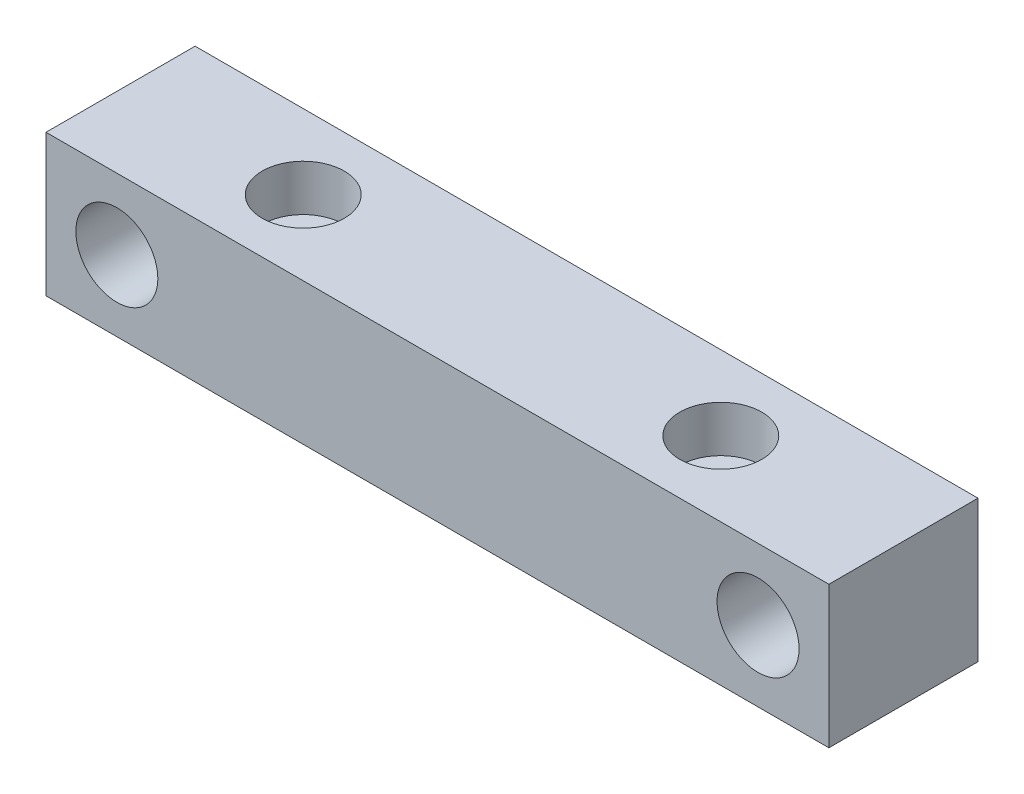
from build123d import *

# Parameters (mm, degrees)
SKETCH1_W           = 52.5
SKETCH1_H           = 9.5
SKETCH1_R           = 1.375
BOSS_EXTRUDE1_DEPTH = 10
SKETCH4_R           = 2.75
CUT_EXTRUDE3_DEPTH  = 7
CUT_EXTRUDE1_REACH  = 54.832
SKETCH2_R           = 1.375
SKETCH3_R           = 2.75
CUT_EXTRUDE2_DEPTH  = 3.1


with BuildPart() as part:
    # Sketch1 → Boss-Extrude1 (new body)
    with BuildSketch(Plane.XY):
        with Locations((-24.75, -6.748746096)):
            Rectangle(SKETCH1_W, SKETCH1_H)
        with Locations((-46.25, -6.748746096)):
            Circle(SKETCH1_R, mode=Mode.SUBTRACT)
        with Locations((-3.25, -6.748746096)):
            Circle(SKETCH1_R, mode=Mode.SUBTRACT)
    extrude(amount=BOSS_EXTRUDE1_DEPTH)

    # Sketch4 → Cut-Extrude3 (cut)
    with BuildSketch(Plane.XY.offset(10)):
        with Locations((-46.25, -6.748746096)):
            Circle(SKETCH4_R)
        with Locations((-3.25, -6.748746096)):
            Circle(SKETCH4_R)
    extrude(amount=-CUT_EXTRUDE3_DEPTH, mode=Mode.SUBTRACT)

    # Sketch2 → Cut-Extrude1 (cut, up to next)
    with BuildSketch(Plane(origin=(0, -1.998746096, 0), x_dir=(1, 0, 0), z_dir=(0, 1, 0)), mode=Mode.PRIVATE) as cut_extrude1_sk1:
        with Locations(Location((-10.75, -5, 0), (0, 0, 270))):
            Circle(SKETCH2_R)
    cut_extrude1_tool1 = extrude(cut_extrude1_sk1.sketch, amount=-CUT_EXTRUDE1_REACH, mode=Mode.PRIVATE) & part.part
    # Sketch2 → Cut-Extrude1 (cut, up to next)
    with BuildSketch(Plane(origin=(0, -1.998746096, 0), x_dir=(1, 0, 0), z_dir=(0, 1, 0)), mode=Mode.PRIVATE) as cut_extrude1_sk2:
        with Locations(Location((-38.75, -5, 0), (0, 0, 270))):
            Circle(SKETCH2_R)
    cut_extrude1_tool2 = extrude(cut_extrude1_sk2.sketch, amount=-CUT_EXTRUDE1_REACH, mode=Mode.PRIVATE) & part.part
    add(cut_extrude1_tool1.solids().sort_by_distance((-10.75, -1.998746, 5))[0], mode=Mode.SUBTRACT)
    add(cut_extrude1_tool2.solids().sort_by_distance((-38.75, -1.998746, 5))[0], mode=Mode.SUBTRACT)

    # Sketch3 → Cut-Extrude2 (cut)
    with BuildSketch(Plane(origin=(0, -1.998746096, 0), x_dir=(1, 0, 0), z_dir=(0, 1, 0))):
        with Locations(Location((-10.75, -5, 0), (0, 0, 270))):
            Circle(SKETCH3_R)
        with Locations(Location((-38.75, -5, 0), (0, 0, 270))):
            Circle(SKETCH3_R)
    extrude(amount=-CUT_EXTRUDE2_DEPTH, mode=Mode.SUBTRACT)


solid = part.part
